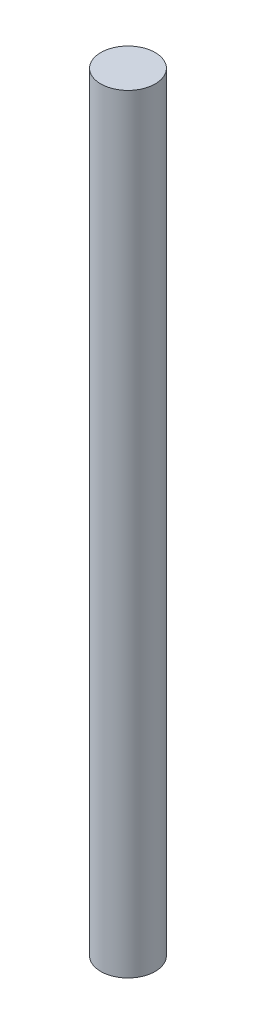
from build123d import *

# Parameters (mm, degrees)
SKETCH1_R           = 4
BOSS_EXTRUDE1_DEPTH = 113


with BuildPart() as part:
    # Sketch1 → Boss-Extrude1 (new body)
    with BuildSketch(Plane(origin=(0, 0, 0), x_dir=(1, 0, 0), z_dir=(0, 1, 0))):
        with Locations(Location((0, 0, 0), (0, 0, 270))):
            Circle(SKETCH1_R)
    extrude(amount=BOSS_EXTRUDE1_DEPTH)


solid = part.part
